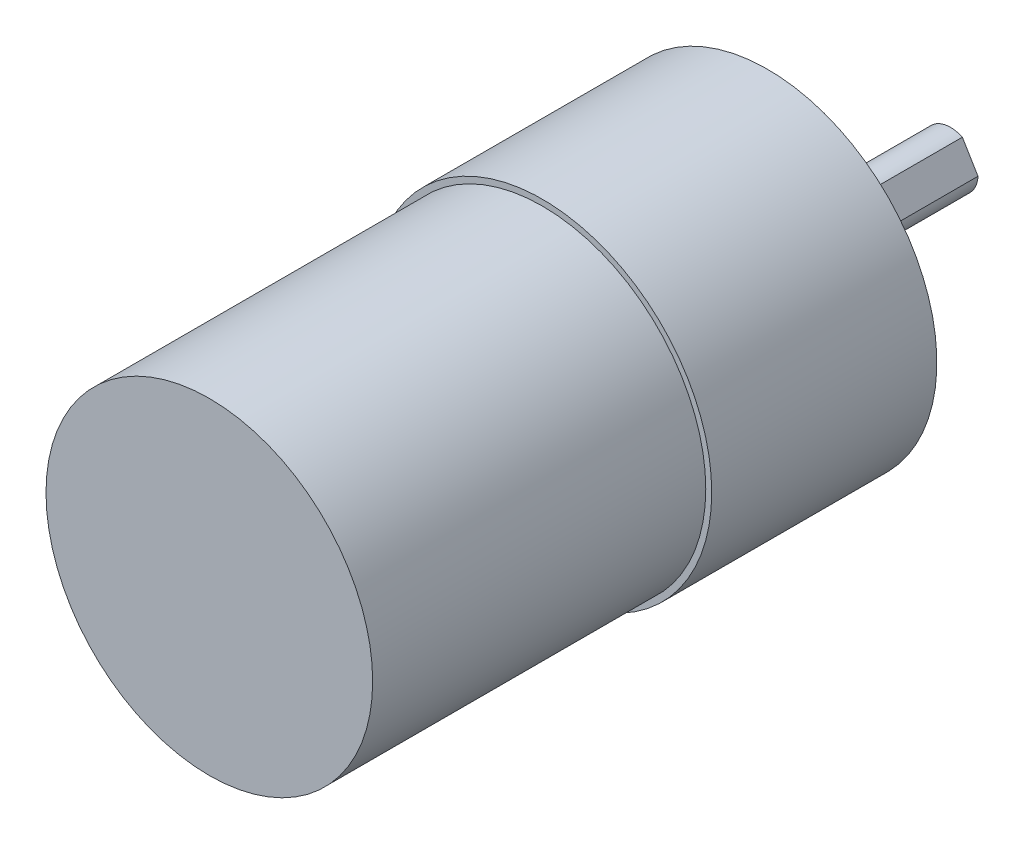
from build123d import *

# Parameters (mm, degrees)
SKETCH2_R           = 18.499999957
BOSS_EXTRUDE1_DEPTH = 81
SKETCH3_R           = 34.5
SKETCH3_R_2         = 5.9
CUT_EXTRUDE1_DEPTH  = 20
SKETCH4_R           = 5.9
SKETCH4_R_2         = 3
CUT_EXTRUDE2_DEPTH  = 15
SKETCH6_R           = 34.5
SKETCH6_R_2         = 17.849200014
CUT_EXTRUDE3_DEPTH  = 36.4
CUT_EXTRUDE11_DEPTH = 15
CUT_EXTRUDE13_DEPTH = 25.4


with BuildPart() as part:
    # Sketch2 → Boss-Extrude1 (new body)
    with BuildSketch(Plane.XY):
        with Locations((-17.902568237, 17.753380168)):
            Circle(SKETCH2_R)
    extrude(amount=BOSS_EXTRUDE1_DEPTH)

    # Sketch3 → Cut-Extrude1 (cut)
    with BuildSketch(Plane(origin=(0, 0, 0), x_dir=(-1, 0, 0), z_dir=(0, 0, -1))):
        with Locations((17.902568237, 17.753380168)):
            Circle(SKETCH3_R)
        with Locations((17.902568237, 17.753380168)):
            Circle(SKETCH3_R_2, mode=Mode.SUBTRACT)
    extrude(amount=-CUT_EXTRUDE1_DEPTH, mode=Mode.SUBTRACT)

    # Sketch4 → Cut-Extrude2 (cut)
    with BuildSketch(Plane(origin=(0, 0, 0), x_dir=(-1, 0, 0), z_dir=(0, 0, -1))):
        with Locations((17.902568237, 17.753380168)):
            Circle(SKETCH4_R)
        with Locations((17.902568237, 17.753380168)):
            Circle(SKETCH4_R_2, mode=Mode.SUBTRACT)
    extrude(amount=-CUT_EXTRUDE2_DEPTH, mode=Mode.SUBTRACT)

    # Sketch6 → Cut-Extrude3 (cut)
    with BuildSketch(Plane.XY.offset(81)):
        with Locations((-17.902568237, 17.753380168)):
            Circle(SKETCH6_R)
        with Locations((-17.902568237, 17.753380168)):
            Circle(SKETCH6_R_2, mode=Mode.SUBTRACT)
    extrude(amount=-CUT_EXTRUDE3_DEPTH, mode=Mode.SUBTRACT)

    # Sketch12 → Cut-Extrude11 (cut)
    with BuildSketch(Plane(origin=(0, 0, 0), x_dir=(-1, 0, 0), z_dir=(0, 0, -1))):
        with BuildLine():
            Line((14.905470459, 17.621452506), (15.747198213, 19.020021419))
            Line((15.747198213, 19.020021419), (16.615935607, 20.463468077))
            ThreePointArc((16.615935607, 20.463468077), (15.33218895, 19.300361203), (14.905470459, 17.621452506))
        make_face()
    extrude(amount=-CUT_EXTRUDE11_DEPTH, mode=Mode.SUBTRACT)

    # Sketch13 → Cut-Extrude13 (cut)
    with BuildSketch(Plane(origin=(0, 0, 0), x_dir=(-1, 0, 0), z_dir=(0, 0, -1))):
        with BuildLine():
            ThreePointArc((5.152568237, 24.509673531), (5.099648896, 24.862102191), (4.945558303, 25.18344703))
            Line((4.945558303, 25.18344703), (3.952568237, 24.509673531))
            Line((3.952568237, 24.509673531), (4.039578171, 23.312832158))
            ThreePointArc((4.039578171, 23.312832158), (4.831320739, 23.692486869), (5.152568237, 24.509673531))
        make_face()
        with BuildLine():
            Line((3.952568237, 24.509673531), (4.945558303, 25.18344703))
            ThreePointArc((4.945558303, 25.18344703), (2.872568237, 25.032741404), (4.039578171, 23.312832158))
            Line((4.039578171, 23.312832158), (3.952568237, 24.509673531))
        make_face()
        with BuildLine():
            Line((17.858689924, 32.689513359), (16.778689924, 33.212581232))
            Line((16.778689924, 33.212581232), (15.785699858, 32.538807733))
            ThreePointArc((15.785699858, 32.538807733), (16.865699858, 32.01573986), (17.858689924, 32.689513359))
        make_face()
        with BuildLine():
            Line((15.785699858, 32.538807733), (16.778689924, 33.212581232))
            Line((16.778689924, 33.212581232), (17.858689924, 32.689513359))
            ThreePointArc((17.858689924, 32.689513359), (17.948305245, 32.944253075), (17.978689924, 33.212581232))
            ThreePointArc((17.978689924, 33.212581232), (16.426261264, 34.359661892), (15.785699858, 32.538807733))
        make_face()
        with BuildLine():
            ThreePointArc((6.276446549, 9.050472467), (5.893633211, 9.929224969), (4.989436616, 10.247313839))
            Line((4.989436616, 10.247313839), (5.076446549, 9.050472467))
            Line((5.076446549, 9.050472467), (6.156446549, 8.527404593))
            ThreePointArc((6.156446549, 8.527404593), (6.246061871, 8.782144309), (6.276446549, 9.050472467))
        make_face()
        with BuildLine():
            Line((5.076446549, 9.050472467), (4.989436616, 10.247313839))
            ThreePointArc((4.989436616, 10.247313839), (4.083456483, 8.376698967), (6.156446549, 8.527404593))
            Line((6.156446549, 8.527404593), (5.076446549, 9.050472467))
        make_face()
        with BuildLine():
            ThreePointArc((31.928689924, 26.45628787), (30.997018081, 27.625903191), (29.648689924, 26.979355743))
            Line((29.648689924, 26.979355743), (30.728689924, 26.45628787))
            Line((30.728689924, 26.45628787), (30.815699858, 25.259446497))
            ThreePointArc((30.815699858, 25.259446497), (31.607442426, 25.639101208), (31.928689924, 26.45628787))
        make_face()
        with BuildLine():
            Line((30.728689924, 26.45628787), (29.648689924, 26.979355743))
            ThreePointArc((29.648689924, 26.979355743), (29.735699858, 25.78251437), (30.815699858, 25.259446497))
            Line((30.815699858, 25.259446497), (30.728689924, 26.45628787))
        make_face()
        with BuildLine():
            ThreePointArc((33.052568237, 10.997086806), (32.669754898, 11.875839308), (31.765558303, 12.193928178))
            Line((31.765558303, 12.193928178), (31.852568237, 10.997086806))
            Line((31.852568237, 10.997086806), (30.859578171, 10.323313306))
            ThreePointArc((30.859578171, 10.323313306), (32.204996897, 9.850006146), (33.052568237, 10.997086806))
        make_face()
        with BuildLine():
            Line((31.852568237, 10.997086806), (31.765558303, 12.193928178))
            ThreePointArc((31.765558303, 12.193928178), (30.772568237, 11.520154679), (30.859578171, 10.323313306))
            Line((30.859578171, 10.323313306), (31.852568237, 10.997086806))
        make_face()
        with BuildLine():
            ThreePointArc((20.019436616, 2.967952604), (18.939436616, 3.491020477), (17.946446549, 2.817246977))
            Line((17.946446549, 2.817246977), (19.026446549, 2.294179104))
            Line((19.026446549, 2.294179104), (20.019436616, 2.967952604))
        make_face()
        with BuildLine():
            Line((19.026446549, 2.294179104), (17.946446549, 2.817246977))
            ThreePointArc((17.946446549, 2.817246977), (18.758118392, 1.124563783), (20.226446549, 2.294179104))
            ThreePointArc((20.226446549, 2.294179104), (20.173527209, 2.646607764), (20.019436616, 2.967952604))
            Line((20.019436616, 2.967952604), (19.026446549, 2.294179104))
        make_face()
    extrude(amount=-CUT_EXTRUDE13_DEPTH, mode=Mode.SUBTRACT)


solid = part.part
